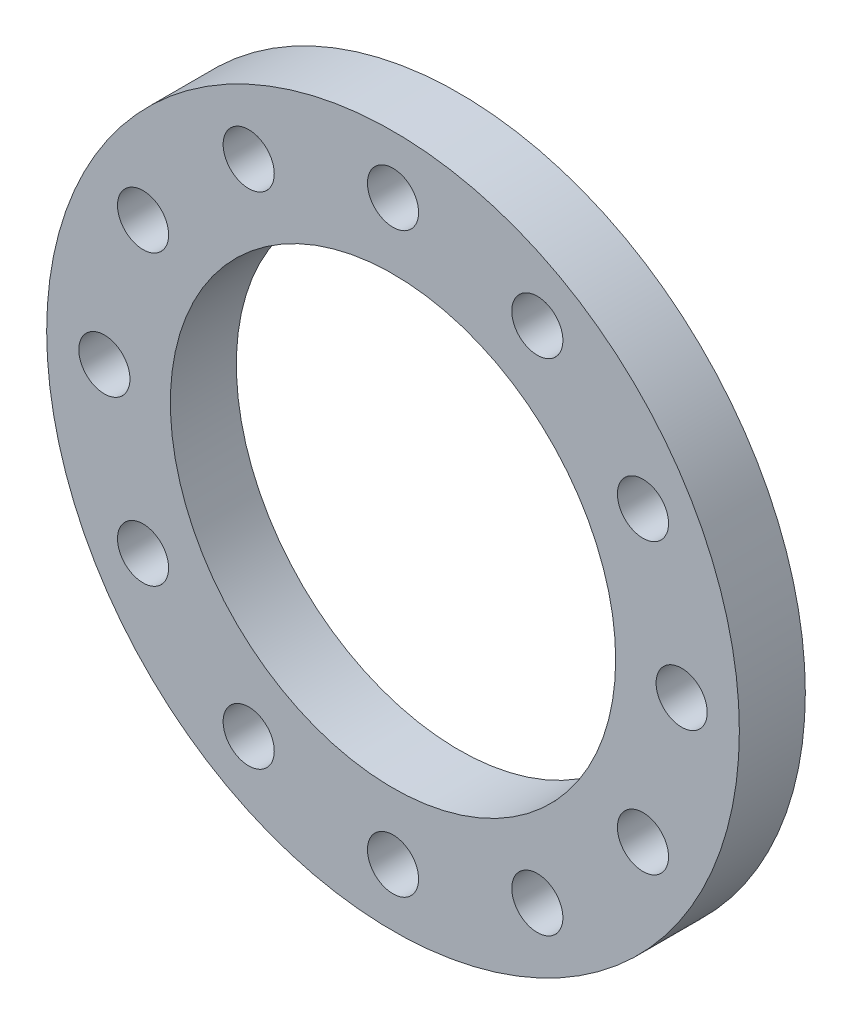
from build123d import *

# Parameters (mm, degrees)
SKETCH_1_R      = 21
SKETCH_1_R_2    = 13.5
SKETCH_1_R_3    = 1.55
EXTRUDE_1_DEPTH = 4


with BuildPart() as part:
    # 草图1 → 凸台-拉伸1 (new body)
    with BuildSketch(Plane.XY):
        Circle(SKETCH_1_R)
        Circle(SKETCH_1_R_2, mode=Mode.SUBTRACT)
        with Locations((0, 17.5)):
            Circle(SKETCH_1_R_3, mode=Mode.SUBTRACT)
        with Locations((17.5, 0)):
            Circle(SKETCH_1_R_3, mode=Mode.SUBTRACT)
        with Locations((0, -17.5)):
            Circle(SKETCH_1_R_3, mode=Mode.SUBTRACT)
        with Locations((-17.5, 0)):
            Circle(SKETCH_1_R_3, mode=Mode.SUBTRACT)
        with Locations((15.155444566, -8.75)):
            Circle(SKETCH_1_R_3, mode=Mode.SUBTRACT)
        with Locations((8.75, 15.155444566)):
            Circle(SKETCH_1_R_3, mode=Mode.SUBTRACT)
        with Locations((-15.155444566, 8.75)):
            Circle(SKETCH_1_R_3, mode=Mode.SUBTRACT)
        with Locations((-8.75, -15.155444566)):
            Circle(SKETCH_1_R_3, mode=Mode.SUBTRACT)
        with Locations((-15.155444566, -8.75)):
            Circle(SKETCH_1_R_3, mode=Mode.SUBTRACT)
        with Locations((8.75, -15.155444566)):
            Circle(SKETCH_1_R_3, mode=Mode.SUBTRACT)
        with Locations((15.155444566, 8.75)):
            Circle(SKETCH_1_R_3, mode=Mode.SUBTRACT)
        with Locations((-8.75, 15.155444566)):
            Circle(SKETCH_1_R_3, mode=Mode.SUBTRACT)
    extrude(amount=EXTRUDE_1_DEPTH)


solid = part.part
